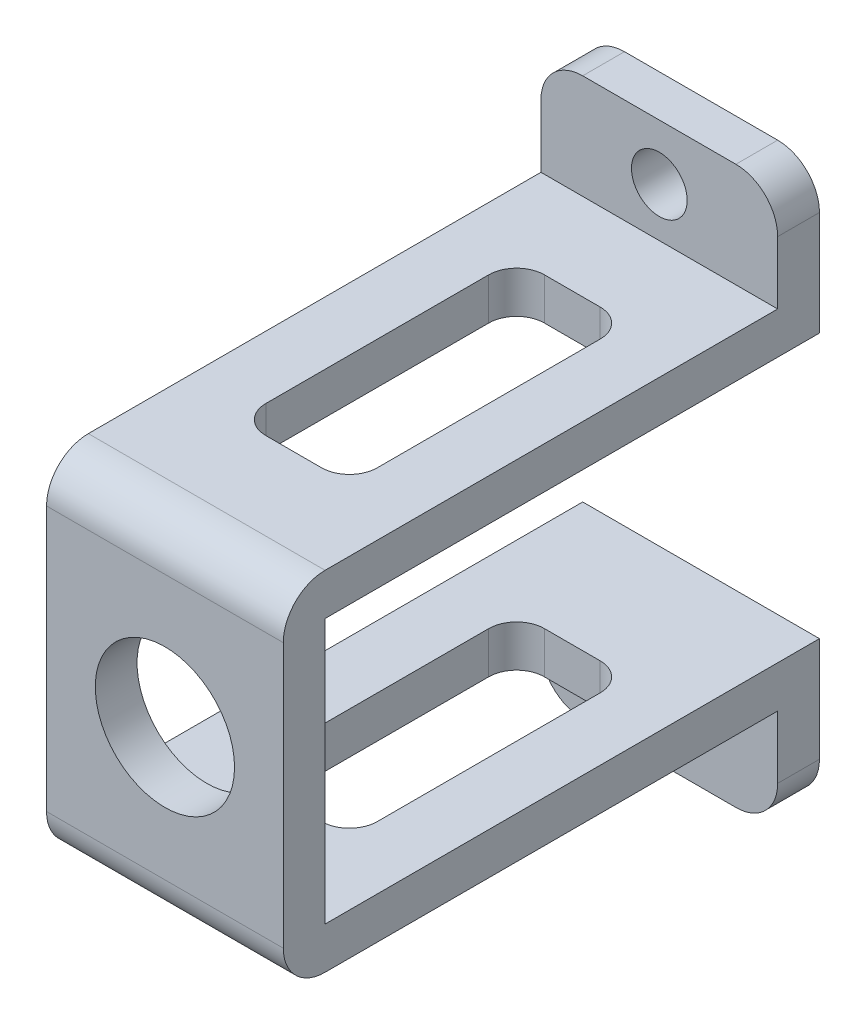
from build123d import *

# Parameters (mm, degrees)
SKETCH_1_R          = 2
EXTRUDE_1_DEPTH     = 2
SKETCH_4_W          = 8
SKETCH_4_H          = 2
EXTRUDE_3_DEPTH     = 35.5
SKETCH_5_R          = 1
CUT_EXTRUDE_1_DEPTH = 8
SKETCH_6_W          = 8
SKETCH_6_H          = 10
EXTRUDE_4_DEPTH     = 2
SKETCH_7_R          = 2
CUT_EXTRUDE_2_DEPTH = 2
EXTRUDE_5_DEPTH     = 4.5
EXTRUDE_6_DEPTH     = 4.5
FILLET_1_R          = 3
SKETCH_10_W         = 17
SKETCH_10_H         = 24
SKETCH_10_R         = 1
SKETCH_10_R_2       = 2
EXTRUDE_7_DEPTH     = 1
SKETCH_12_W         = 17
SKETCH_12_H         = 35.5
EXTRUDE_8_DEPTH     = 0.5
SKETCH_13_W         = 17
SKETCH_13_H         = 35.5
EXTRUDE_9_DEPTH     = 0.5
EXTRUDE_START       = 1
SKETCH_14_R         = 2
EXTRUDE_10_DEPTH    = 1
SKETCH_16_W         = 17
SKETCH_16_H         = 35.5
EXTRUDE_11_DEPTH    = 0.5
SKETCH_17_W         = 17
SKETCH_17_H         = 35.5
EXTRUDE_12_DEPTH    = 0.5
EXTRUDE_START_2     = -3
SKETCH_18_R         = 1
EXTRUDE_13_DEPTH    = 3
SKETCH_19_R         = 5
CUT_EXTRUDE_3_DEPTH = 3
SKETCH_20_W         = 8
SKETCH_20_H         = 20
CUT_EXTRUDE_4_DEPTH = 34
FILLET_3_R          = 2
FILLET_4_R          = 3


with BuildPart() as part:
    # 草图1 → 凸台-拉伸1 (new body)
    # profile 1 of 5: a face of its own
    with BuildSketch(Plane.XY):
        with BuildLine():
            Line((4, 6.34428877), (4, -6.34428877))
            ThreePointArc((4, -6.34428877), (6.566962768, -3.622844187), (7.5, 0))
            ThreePointArc((7.5, 0), (6.566962768, 3.622844187), (4, 6.34428877))
        make_face()
    # profile 2 of 5: a face of its own
    with BuildSketch(Plane.XY):
        with BuildLine():
            Line((-4, 6.34428877), (-4, -6.34428877))
            ThreePointArc((-4, -6.34428877), (0, -7.5), (4, -6.34428877))
            Line((4, -6.34428877), (4, 6.34428877))
            ThreePointArc((4, 6.34428877), (0, 7.5), (-4, 6.34428877))
        make_face()
        Circle(SKETCH_1_R, mode=Mode.SUBTRACT)
    # profile 3 of 5: a face of its own
    with BuildSketch(Plane.XY):
        with BuildLine():
            ThreePointArc((-4, 6.34428877), (-7.5, 0), (-4, -6.34428877))
            Line((-4, -6.34428877), (-4, 6.34428877))
        make_face()
    # profile 4 of 5: a face of its own
    with BuildSketch(Plane.XY):
        with BuildLine():
            Line((-4, 10), (-4, 6.34428877))
            ThreePointArc((-4, 6.34428877), (0, 7.5), (4, 6.34428877))
            Line((4, 6.34428877), (4, 10))
            Line((4, 10), (-4, 10))
        make_face()
    # profile 5 of 5: a face of its own
    with BuildSketch(Plane.XY):
        with BuildLine():
            Line((-4, -6.34428877), (-4, -10))
            Line((-4, -10), (4, -10))
            Line((4, -10), (4, -6.34428877))
            ThreePointArc((4, -6.34428877), (0, -7.5), (-4, -6.34428877))
        make_face()
    extrude(amount=EXTRUDE_1_DEPTH)

    # 草图4 → 凸台-拉伸3 (add)
    with BuildSketch(Plane.XY.offset(2)):
        with Locations((0, -11)):
            Rectangle(SKETCH_4_W, SKETCH_4_H)
        with Locations((0, 11)):
            Rectangle(SKETCH_4_W, SKETCH_4_H)
    extrude(amount=-EXTRUDE_3_DEPTH)

    # 草图5 → 切除-拉伸1 (cut)
    with BuildSketch(Plane(origin=(0, 0, 0), x_dir=(-1, 0, 0), z_dir=(0, 0, -1))):
        with Locations((0, 5.5)):
            Circle(SKETCH_5_R)
        with Locations((0, -5.5)):
            Circle(SKETCH_5_R)
    extrude(amount=-CUT_EXTRUDE_1_DEPTH, mode=Mode.SUBTRACT)

    # 草图6 → 凸台-拉伸4 (add)
    with BuildSketch(Plane(origin=(0, 0, -33.5), x_dir=(-1, 0, 0), z_dir=(0, 0, -1))):
        with Locations((0, -15)):
            Rectangle(SKETCH_6_W, SKETCH_6_H)
        with Locations((0, 15)):
            Rectangle(SKETCH_6_W, SKETCH_6_H)
    extrude(amount=EXTRUDE_4_DEPTH)

    # 草图7 → 切除-拉伸2 (cut)
    with BuildSketch(Plane.XY.offset(-33.5)):
        with Locations((0, 16)):
            Circle(SKETCH_7_R)
        with Locations((0, -16)):
            Circle(SKETCH_7_R)
    extrude(amount=-CUT_EXTRUDE_2_DEPTH, mode=Mode.SUBTRACT)

    # 草图8 → 凸台-拉伸5 (add)
    with BuildSketch(Plane.ZY.offset(4)):
        Polygon((-35.5, 10), (0, 10), (0, 6.34428877), (2, 6.34428877), (2, 12), (-33.5, 12), (-33.5, 20), (-35.5, 20), align=None)
        Polygon((-33.5, -12), (2, -12), (2, -6.34428877), (2, 6.34428877), (0, 6.34428877), (0, -6.34428877), (0, -10), (-35.5, -10), (-35.5, -20), (-33.5, -20), align=None)
    extrude(amount=EXTRUDE_5_DEPTH)

    # 草图9 → 凸台-拉伸6 (add)
    with BuildSketch(Plane(origin=(4, 0, 0), x_dir=(0, 0, -1), z_dir=(1, 0, 0))):
        Polygon((-2, 6.34428877), (-2, -6.34428877), (-2, -12), (33.5, -12), (33.5, -20), (35.5, -20), (35.5, -10), (0, -10), (0, -6.34428877), (0, 6.34428877), (0, 10), (35.5, 10), (35.5, 20), (33.5, 20), (33.5, 12), (-2, 12), align=None)
    extrude(amount=EXTRUDE_6_DEPTH)

    # 圆角1
    fillet_1_edges = [part.edges().sort_by_distance(p)[0] for p in [
        (-8.5, -20, -34.5),
        (-8.5, 20, -34.5),
        (8.5, 20, -34.5),
        (8.5, -20, -34.5),
    ]]
    fillet(fillet_1_edges, radius=FILLET_1_R)

    # 草图10 → 凸台-拉伸7 (add)
    with BuildSketch(Plane.XY.offset(2)):
        Rectangle(SKETCH_10_W, SKETCH_10_H)
        with Locations(Location((0, -5.5, 0), (0, 0, 180))):
            Circle(SKETCH_10_R, mode=Mode.SUBTRACT)
        Circle(SKETCH_10_R_2, mode=Mode.SUBTRACT)
        with Locations(Location((0, 5.5, 0), (0, 0, 180))):
            Circle(SKETCH_10_R, mode=Mode.SUBTRACT)
    extrude(amount=EXTRUDE_7_DEPTH)

    # 草图12 → 凸台-拉伸8 (add)
    with BuildSketch(Plane.XZ.offset(-10)):
        with Locations((0, -17.75)):
            Rectangle(SKETCH_12_W, SKETCH_12_H)
    extrude(amount=EXTRUDE_8_DEPTH)

    # 草图13 → 凸台-拉伸9 (add)
    with BuildSketch(Plane(origin=(0, -10, 0), x_dir=(1, 0, 0), z_dir=(0, 1, 0))):
        with Locations((0, 17.75)):
            Rectangle(SKETCH_13_W, SKETCH_13_H)
    extrude(amount=EXTRUDE_9_DEPTH)

    # 草图14 → 凸台-拉伸10 (add)
    # profile 1 of 2: a face of its own
    with BuildSketch(Plane.XY.offset(-33.5).offset(EXTRUDE_START)):
        with BuildLine():
            Line((-8.5, -12), (-8.5, -17))
            ThreePointArc((-8.5, -17), (-7.621320344, -19.121320344), (-5.5, -20))
            Line((-5.5, -20), (5.5, -20))
            ThreePointArc((5.5, -20), (7.621320344, -19.121320344), (8.5, -17))
            Line((8.5, -17), (8.5, -12))
            Line((8.5, -12), (-8.5, -12))
        make_face()
        with Locations((0, -16)):
            Circle(SKETCH_14_R, mode=Mode.SUBTRACT)
    # profile 2 of 2: a face of its own
    with BuildSketch(Plane.XY.offset(-33.5).offset(EXTRUDE_START)):
        with BuildLine():
            Line((5.5, 20), (-5.5, 20))
            ThreePointArc((-5.5, 20), (-7.621320344, 19.121320344), (-8.5, 17))
            Line((-8.5, 17), (-8.5, 12))
            Line((-8.5, 12), (8.5, 12))
            Line((8.5, 12), (8.5, 17))
            ThreePointArc((8.5, 17), (7.621320344, 19.121320344), (5.5, 20))
        make_face()
        with Locations((0, 16)):
            Circle(SKETCH_14_R, mode=Mode.SUBTRACT)
    extrude(amount=-EXTRUDE_10_DEPTH)

    # 草图16 → 凸台-拉伸11 (add)
    with BuildSketch(Plane.XZ.offset(12)):
        with Locations((0, -14.75)):
            Rectangle(SKETCH_16_W, SKETCH_16_H)
    extrude(amount=EXTRUDE_11_DEPTH)

    # 草图17 → 凸台-拉伸12 (add)
    with BuildSketch(Plane(origin=(0, 12, 0), x_dir=(1, 0, 0), z_dir=(0, 1, 0))):
        with Locations((0, 14.75)):
            Rectangle(SKETCH_17_W, SKETCH_17_H)
    extrude(amount=EXTRUDE_12_DEPTH)

    # 草图18 → 凸台-拉伸13 (add)
    with BuildSketch(Plane.XY.offset(3).offset(EXTRUDE_START_2)):
        with Locations((0, -5.5)):
            Circle(SKETCH_18_R)
        with Locations((0, 5.5)):
            Circle(SKETCH_18_R)
    extrude(amount=EXTRUDE_13_DEPTH)

    # 草图19 → 切除-拉伸3 (cut)
    with BuildSketch(Plane.XY.offset(3)):
        Circle(SKETCH_19_R)
    extrude(amount=-CUT_EXTRUDE_3_DEPTH, mode=Mode.SUBTRACT)

    # 草图20 → 切除-拉伸4 (cut)
    with BuildSketch(Plane(origin=(0, 12.5, 0), x_dir=(1, 0, 0), z_dir=(0, 1, 0))):
        with Locations((0, 16.249764914)):
            Rectangle(SKETCH_20_W, SKETCH_20_H)
    extrude(amount=-CUT_EXTRUDE_4_DEPTH, mode=Mode.SUBTRACT)

    # 圆角3
    fillet_3_edges = [part.edges().sort_by_distance(p)[0] for p in [
        (4, 11, -26.249764914),
        (4, 11, -6.249764914),
        (-4, 11, -6.249764914),
        (-4, 11, -26.249764914),
        (4, -11, -26.249764914),
        (4, -11, -6.249764914),
        (-4, -11, -6.249764914),
        (-4, -11, -26.249764914),
    ]]
    fillet(fillet_3_edges, radius=FILLET_3_R)

    # 圆角4
    fillet_4_edges = [part.edges().sort_by_distance(p)[0] for p in [
        (0, -12.5, 3),
        (0, 12.5, 3),
    ]]
    fillet(fillet_4_edges, radius=FILLET_4_R)


solid = part.part
